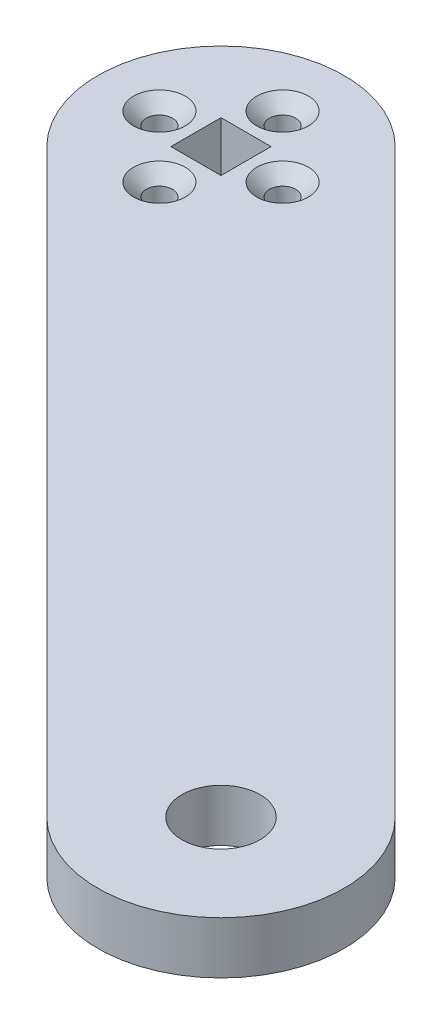
from build123d import *

# Parameters (mm, degrees)
SKETCH2_R                                       = 4.7625
SKETCH2_W                                       = 6.1
SKETCH2_H                                       = 6.1
BOSS_EXTRUDE1_DEPTH                             = 6.35
CSK_FOR_M3_FLAT_HEAD_MACHINE_SCREW1_D           = 3.2
CSK_FOR_M3_FLAT_HEAD_MACHINE_SCREW1_CSINK_D     = 6.3
CSK_FOR_M3_FLAT_HEAD_MACHINE_SCREW1_CSINK_ANGLE = 90


with BuildPart() as part:
    # Sketch2 → Boss-Extrude1 (new body)
    with BuildSketch(Plane(origin=(0, 0, 0), x_dir=(1, 0, 0), z_dir=(0, 1, 0))):
        with BuildLine():
            Line((10.606601718, 10.606601718), (81.317279836, -60.104076401))
            ThreePointArc((81.317279836, -60.104076401), (81.317279836, -81.317279836), (60.104076401, -81.317279836))
            Line((60.104076401, -81.317279836), (-10.606601718, -10.606601718))
            ThreePointArc((-10.606601718, -10.606601718), (-10.606601718, 10.606601718), (10.606601718, 10.606601718))
        make_face()
        with Locations(Location((70.710678119, -70.710678119, 0), (0, 0, 270))):
            Circle(SKETCH2_R, mode=Mode.SUBTRACT)
        Rectangle(SKETCH2_W, SKETCH2_H, mode=Mode.SUBTRACT)
    extrude(amount=-BOSS_EXTRUDE1_DEPTH)

    # CSK for M3 Flat Head Machine Screw1 (through all)
    with Locations(Plane(origin=(0, 0, -7.5), x_dir=(0, 0, 1), z_dir=(0, 1, 0))):
        with Locations((0, 0), (7.5, -7.5), (7.5, 7.5), (15, 0)):
            CounterSinkHole(CSK_FOR_M3_FLAT_HEAD_MACHINE_SCREW1_D / 2, CSK_FOR_M3_FLAT_HEAD_MACHINE_SCREW1_CSINK_D / 2, counter_sink_angle=CSK_FOR_M3_FLAT_HEAD_MACHINE_SCREW1_CSINK_ANGLE)


solid = part.part
